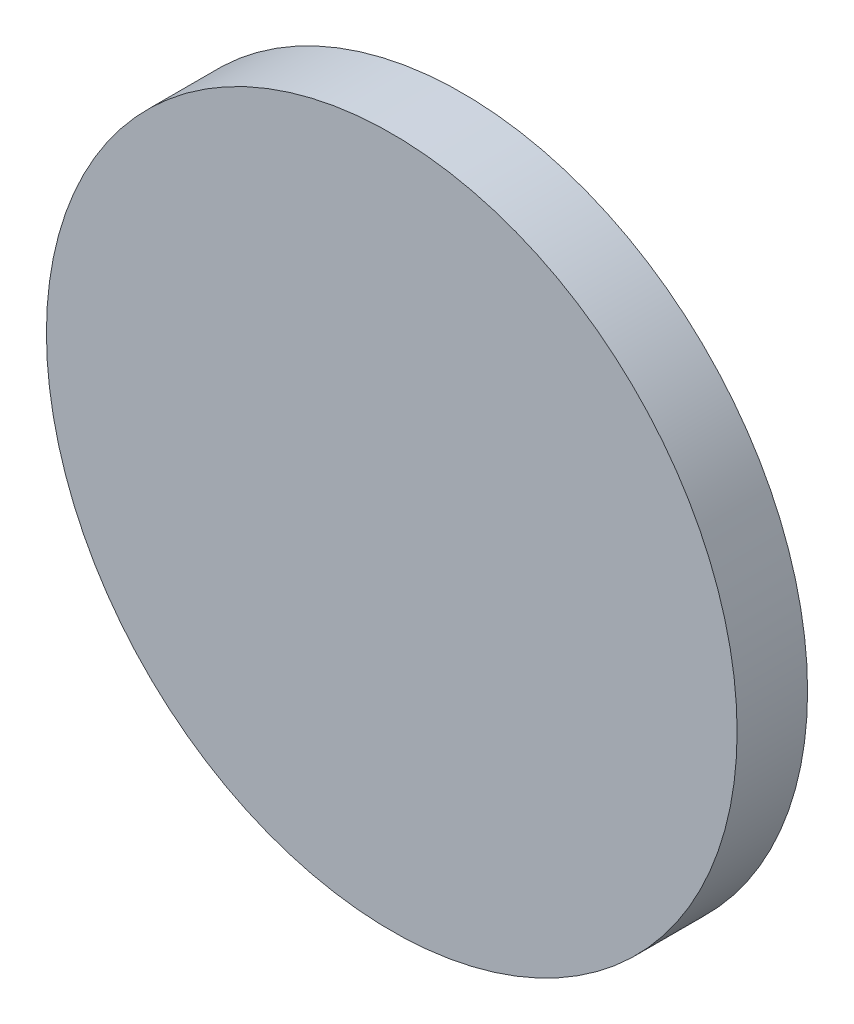
from build123d import *


with BuildPart() as part:
    # 草图1 → 旋转1 (revolve)
    with BuildSketch(Plane(origin=(0, 0, 0), x_dir=(1, 0, 0), z_dir=(0, 1, 0))):
        with BuildLine():
            Line((10, 0), (10, -2.04))
            Line((10, -2.04), (0, -2.04))
            Line((0, -2.04), (0, 1.657198498))
            ThreePointArc((0, 1.657198498), (5.068192648, 1.24009279), (10, 0))
        make_face()
    revolve(axis=Axis((0, 0, 2.04), (0, 0, -1)))


solid = part.part
